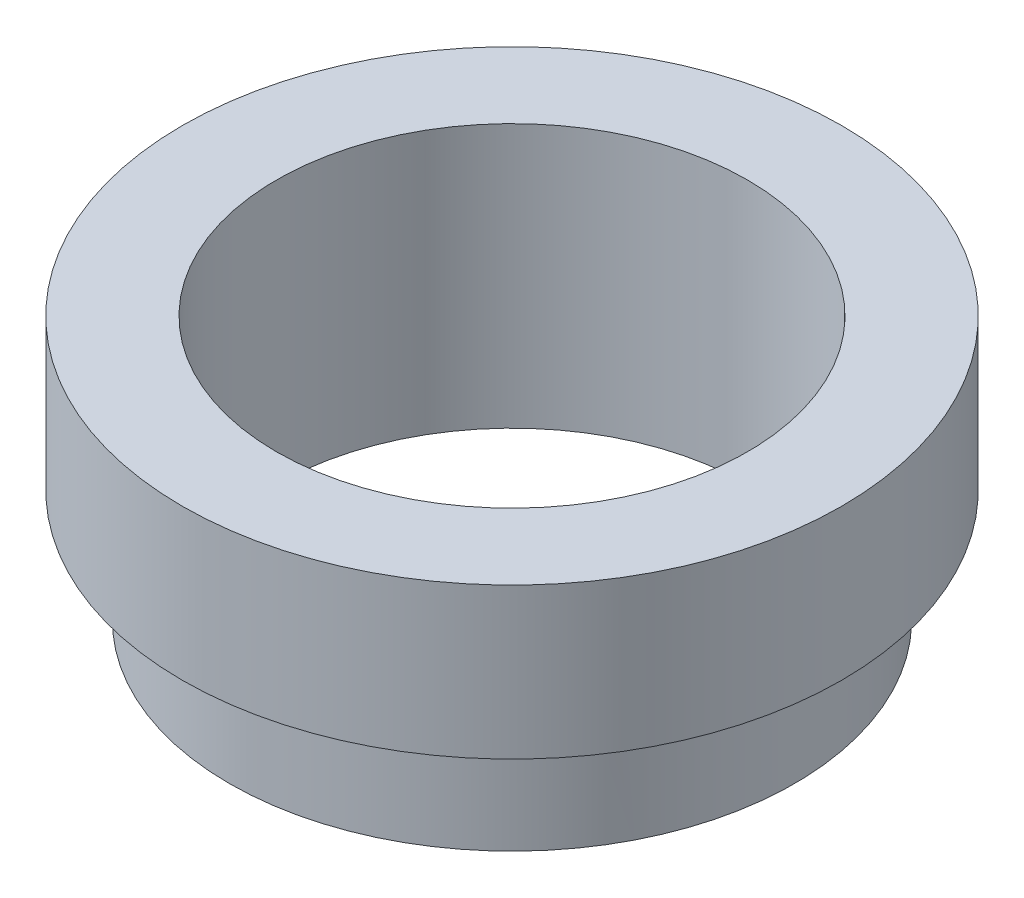
from build123d import *
from build123d.topology import SkipClean

# Parameters (mm, degrees)
SKETCH1_R           = 17.5
SKETCH1_R_2         = 12.5
BOSS_EXTRUDE1_DEPTH = 8
BOSS_EXTRUDE2_START = 6
SKETCH2_R           = 15
SKETCH2_R_2         = 12.5
BOSS_EXTRUDE2_DEPTH = 6


with BuildPart() as part:
    # Sketch1 → Boss-Extrude1 (new body)
    with BuildSketch(Plane(origin=(0, 0, 0), x_dir=(1, 0, 0), z_dir=(0, 1, 0))):
        with Locations(Location((0, 0, 0), (0, 0, 270))):
            Circle(SKETCH1_R)
        with Locations(Location((0, 0, 0), (0, 0, 270))):
            Circle(SKETCH1_R_2, mode=Mode.SUBTRACT)
    extrude(amount=BOSS_EXTRUDE1_DEPTH)

    # Sketch2 → Boss-Extrude2 (add)
    with SkipClean():  # the faces are left unmerged after this step: merging them gives an invalid solid
        with BuildSketch(Plane.XZ.offset(BOSS_EXTRUDE2_START)):
            with Locations(Location((0, 0, 0), (0, 0, 90))):
                Circle(SKETCH2_R)
            with Locations(Location((0, 0, 0), (0, 0, 270))):
                Circle(SKETCH2_R_2, mode=Mode.SUBTRACT)
        extrude(amount=-BOSS_EXTRUDE2_DEPTH)


solid = part.part
